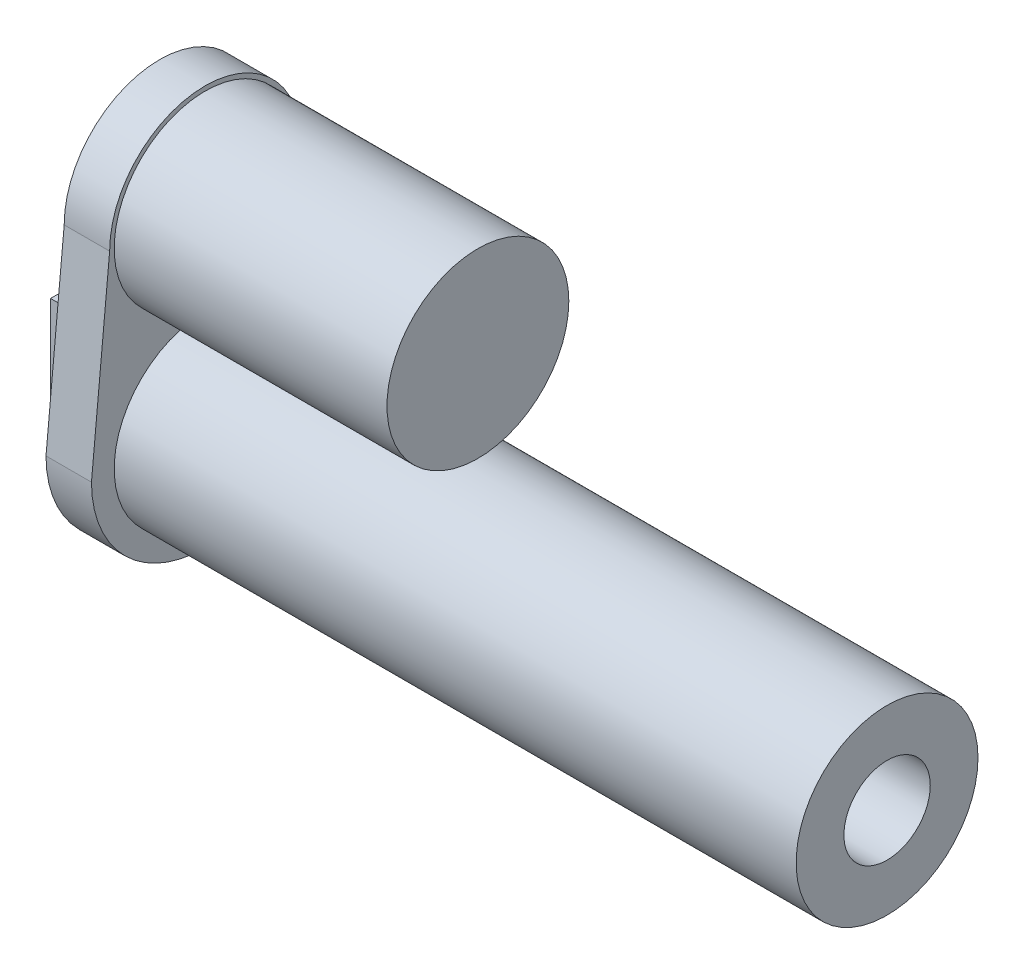
from build123d import *

# Parameters (mm, degrees)
BOSS_EXTRUDE1_DEPTH = 10
BOSS_EXTRUDE2_DEPTH = 20
SKETCH3_R           = 4.5
CUT_EXTRUDE1_DEPTH  = 73.18032973
SKETCH5_R           = 20
BOSS_EXTRUDE4_DEPTH = 150
BOSS_EXTRUDE5_DEPTH = 60
SKETCH7_R           = 9.5
CUT_EXTRUDE2_DEPTH  = 150


with BuildPart() as part:
    # Sketch1 → Boss-Extrude1 (new body)
    with BuildSketch(Plane(origin=(0, 0, 0), x_dir=(0, 0, -1), z_dir=(1, 0, 0))):
        with BuildLine():
            Line((-21, 42), (-25, 0))
            ThreePointArc((-25, 0), (0, -25), (25, 0))
            Line((25, 0), (21, 42))
            ThreePointArc((21, 42), (0, 63), (-21, 42))
        make_face()
    extrude(amount=BOSS_EXTRUDE1_DEPTH)

    # Sketch2 → Boss-Extrude2 (add)
    with BuildSketch(Plane.ZY):
        Polygon((0, 9.5), (-4, 9.5), (-4, -9.5), (4, -9.5), (4, 9.5), align=None)
    extrude(amount=BOSS_EXTRUDE2_DEPTH)

    # Sketch3 → Cut-Extrude1 (cut, through all)
    with BuildSketch(Plane(origin=(0, 0, -4), x_dir=(-1, 0, 0), z_dir=(0, 0, -1))):
        with Locations(Location((11, 0, 0), (0, 0, 90))):
            Circle(SKETCH3_R)
    extrude(amount=-CUT_EXTRUDE1_DEPTH, mode=Mode.SUBTRACT)

    # Sketch5 → Boss-Extrude4 (add)
    with BuildSketch(Plane(origin=(10, 0, 0), x_dir=(0, 0, -1), z_dir=(1, 0, 0))):
        Circle(SKETCH5_R)
    extrude(amount=BOSS_EXTRUDE4_DEPTH)

    # Sketch6 → Boss-Extrude5 (add)
    with BuildSketch(Plane(origin=(10, 0, 0), x_dir=(0, 0, -1), z_dir=(1, 0, 0))):
        with BuildLine():
            ThreePointArc((-20, 42), (0, 22), (20, 42))
            Line((20, 42), (-20, 42))
        make_face()
        with BuildLine():
            Line((-20, 42), (20, 42))
            ThreePointArc((20, 42), (0, 62), (-20, 42))
        make_face()
    extrude(amount=BOSS_EXTRUDE5_DEPTH)

    # Sketch7 → Cut-Extrude2 (cut)
    with BuildSketch(Plane(origin=(160, 0, 0), x_dir=(0, 0, -1), z_dir=(1, 0, 0))):
        Circle(SKETCH7_R)
    extrude(amount=-CUT_EXTRUDE2_DEPTH, mode=Mode.SUBTRACT)


solid = part.part
